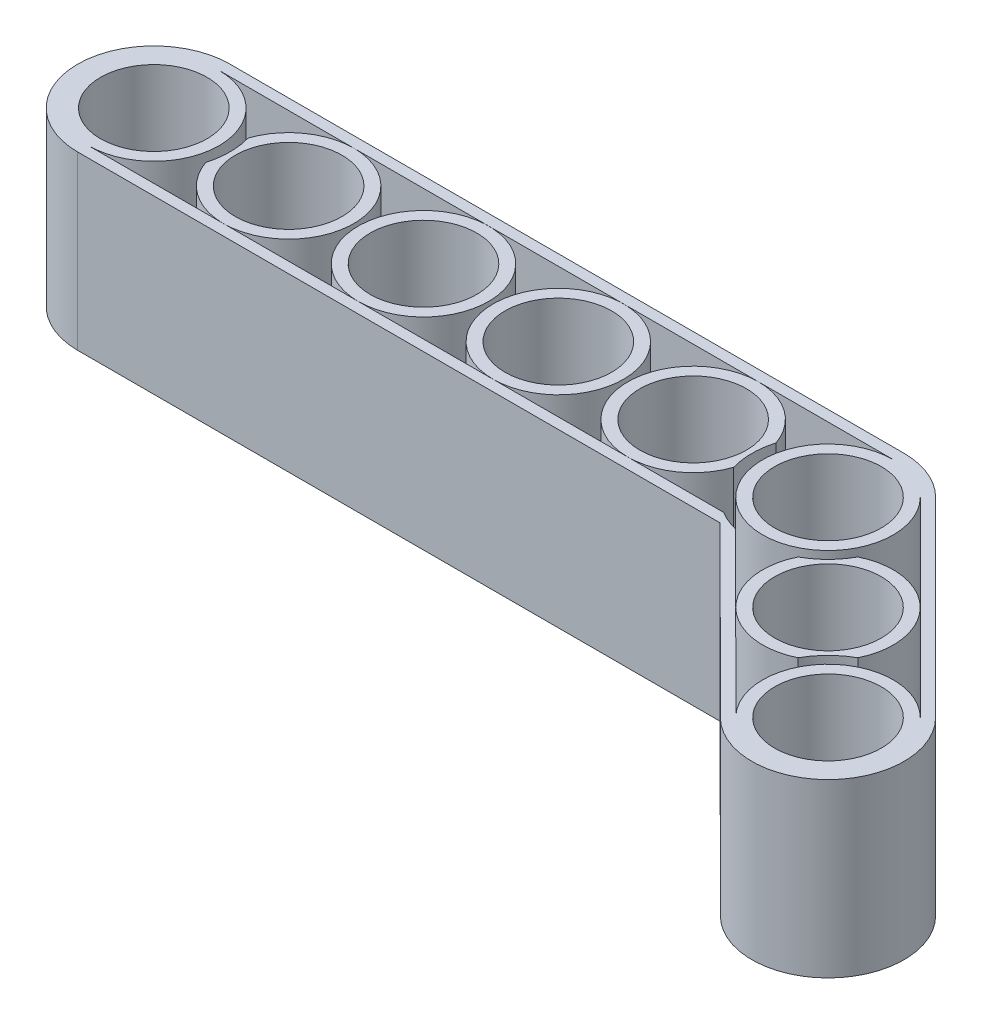
from build123d import *

# Parameters (mm, degrees)
SKETCH1_R             = 2.45
BOSS_EXTRUDE1_DEPTH   = 7.9
BOSS_EXTRUDE1_2_DEPTH = 7.9
BOSS_EXTRUDE1_3_DEPTH = 7.9
BOSS_EXTRUDE1_4_DEPTH = 7.9
BOSS_EXTRUDE1_5_DEPTH = 7.9
BOSS_EXTRUDE1_6_DEPTH = 7.9


with BuildPart() as part:
    # Sketch1 → Boss-Extrude1 (new body)
    with BuildSketch(Plane(origin=(0, 0, 0), x_dir=(1, 0, 0), z_dir=(0, 1, 0))):
        with BuildLine():
            ThreePointArc((3.362096774, 0.972782237), (3.5, 0), (3.362096774, -0.972782237))
            ThreePointArc((3.362096774, -0.972782237), (4.456203382, -2.441141814), (6.2, -3))
            ThreePointArc((6.2, -3), (9.2, 0), (6.2, 3))
            ThreePointArc((6.2, 3), (4.456203382, 2.441141814), (3.362096774, 0.972782237))
        make_face()
        with Locations(Location((6.2, 0, 0), (0, 0, 270))):
            Circle(SKETCH1_R, mode=Mode.SUBTRACT)
    extrude(amount=BOSS_EXTRUDE1_DEPTH)


with BuildPart() as body_2:
    # Sketch1 → Boss-Extrude1 2 (new body)
    with BuildSketch(Plane(origin=(0, 0, 0), x_dir=(1, 0, 0), z_dir=(0, 1, 0))):
        with BuildLine():
            ThreePointArc((12.4, 3), (9.4, 0), (12.4, -3))
            ThreePointArc((12.4, -3), (15.4, 0), (12.4, 3))
        make_face()
        with Locations(Location((12.4, 0, 0), (0, 0, 270))):
            Circle(SKETCH1_R, mode=Mode.SUBTRACT)
    extrude(amount=BOSS_EXTRUDE1_2_DEPTH)


with BuildPart() as body_3:
    # Sketch1 → Boss-Extrude1 3 (new body)
    with BuildSketch(Plane(origin=(0, 0, 0), x_dir=(1, 0, 0), z_dir=(0, 1, 0))):
        with BuildLine():
            Line((42.242997821, -6.293250353), (33.474873734, 2.474873734))
            ThreePointArc((33.474873734, 2.474873734), (32.339392013, 3.233578364), (31, 3.5))
            Line((31, 3.5), (0, 3.5))
            ThreePointArc((0, 3.5), (-3.5, 0), (0, -3.5))
            Line((0, -3.5), (29.541622158, -3.5))
            Line((29.541622158, -3.5), (37.294629097, -11.244375798))
            ThreePointArc((37.294629097, -11.244375798), (42.243686905, -11.242308545), (42.242997821, -6.293250353))
        make_face()
        with Locations(Location((39.768124087, -8.768124087, 0), (0, 0, 270))):
            Circle(SKETCH1_R, mode=Mode.SUBTRACT)
        with Locations(Location((0, 0, 0), (0, 0, 270))):
            Circle(SKETCH1_R, mode=Mode.SUBTRACT)
        with BuildLine():
            Line((6.2, 3), (12.4, 3))
            Line((12.4, 3), (18.6, 3))
            Line((18.6, 3), (24.8, 3))
            Line((24.8, 3), (31, 3))
            ThreePointArc((31, 3), (29.851949677, -2.771638587), (33.121320383, 2.121320304))
            Line((33.121320383, 2.121320304), (37.505382392, -2.262741705))
            Line((37.505382392, -2.262741705), (41.889445139, -6.646804452))
            ThreePointArc((41.889445139, -6.646804452), (37.693998863, -6.600636011), (37.555518704, -10.794050398))
            Line((37.555518704, -10.794050398), (33.263757463, -6.506397664))
            Line((33.263757463, -6.506397664), (30.149460625, -3.395082145))
            ThreePointArc((30.149460625, -3.395082145), (29.658716058, -3.232794052), (29.197224362, -3))
            Line((29.197224362, -3), (24.8, -3))
            Line((24.8, -3), (18.6, -3))
            Line((18.6, -3), (12.4, -3))
            Line((12.4, -3), (6.2, -3))
            Line((6.2, -3), (0, -3))
            ThreePointArc((0, -3), (3, 0), (0, 3))
            Line((0, 3), (6.2, 3))
        make_face(mode=Mode.SUBTRACT)
        with Locations(Location((31, 0, 0), (0, 0, 270))):
            Circle(SKETCH1_R, mode=Mode.SUBTRACT)
    extrude(amount=BOSS_EXTRUDE1_3_DEPTH)


with BuildPart() as body_4:
    # Sketch1 → Boss-Extrude1 4 (new body)
    with BuildSketch(Plane(origin=(0, 0, 0), x_dir=(1, 0, 0), z_dir=(0, 1, 0))):
        with BuildLine():
            ThreePointArc((18.6, 3), (15.6, 0), (18.6, -3))
            ThreePointArc((18.6, -3), (21.6, 0), (18.6, 3))
        make_face()
        with Locations(Location((18.6, 0, 0), (0, 0, 270))):
            Circle(SKETCH1_R, mode=Mode.SUBTRACT)
    extrude(amount=BOSS_EXTRUDE1_4_DEPTH)


with BuildPart() as body_5:
    # Sketch1 → Boss-Extrude1 5 (new body)
    with BuildSketch(Plane(origin=(0, 0, 0), x_dir=(1, 0, 0), z_dir=(0, 1, 0))):
        with BuildLine():
            ThreePointArc((27.637903226, 0.972782237), (26.543796618, 2.441141814), (24.8, 3))
            ThreePointArc((24.8, 3), (21.8, 0), (24.8, -3))
            ThreePointArc((24.8, -3), (26.543796618, -2.441141814), (27.637903226, -0.972782237))
            ThreePointArc((27.637903226, -0.972782237), (27.5, 0), (27.637903226, 0.972782237))
        make_face()
        with Locations(Location((24.8, 0, 0), (0, 0, 270))):
            Circle(SKETCH1_R, mode=Mode.SUBTRACT)
    extrude(amount=BOSS_EXTRUDE1_5_DEPTH)


with BuildPart() as body_6:
    # Sketch1 → Boss-Extrude1 6 (new body)
    with BuildSketch(Plane(origin=(0, 0, 0), x_dir=(1, 0, 0), z_dir=(0, 1, 0))):
        with BuildLine():
            ThreePointArc((32.689500512, -3.065222345), (32.424981812, -4.877867861), (33.263757463, -6.506397664))
            ThreePointArc((33.263757463, -6.506397664), (34.891672855, -7.34337833), (36.702901742, -7.078623575))
            ThreePointArc((36.702901742, -7.078623575), (37.293250353, -6.293250353), (38.078623575, -5.702901742))
            ThreePointArc((38.078623575, -5.702901742), (38.343260388, -3.89096453), (37.505382392, -2.262741705))
            ThreePointArc((37.505382392, -2.262741705), (35.877159564, -1.4248637), (34.065222345, -1.689500512))
            ThreePointArc((34.065222345, -1.689500512), (33.474873734, -2.474873734), (32.689500512, -3.065222345))
        make_face()
        with Locations(Location((35.384062043, -4.384062043, 0), (0, 0, 270))):
            Circle(SKETCH1_R, mode=Mode.SUBTRACT)
    extrude(amount=BOSS_EXTRUDE1_6_DEPTH)


solid = Compound([part.part, body_2.part, body_3.part, body_4.part, body_5.part, body_6.part])
